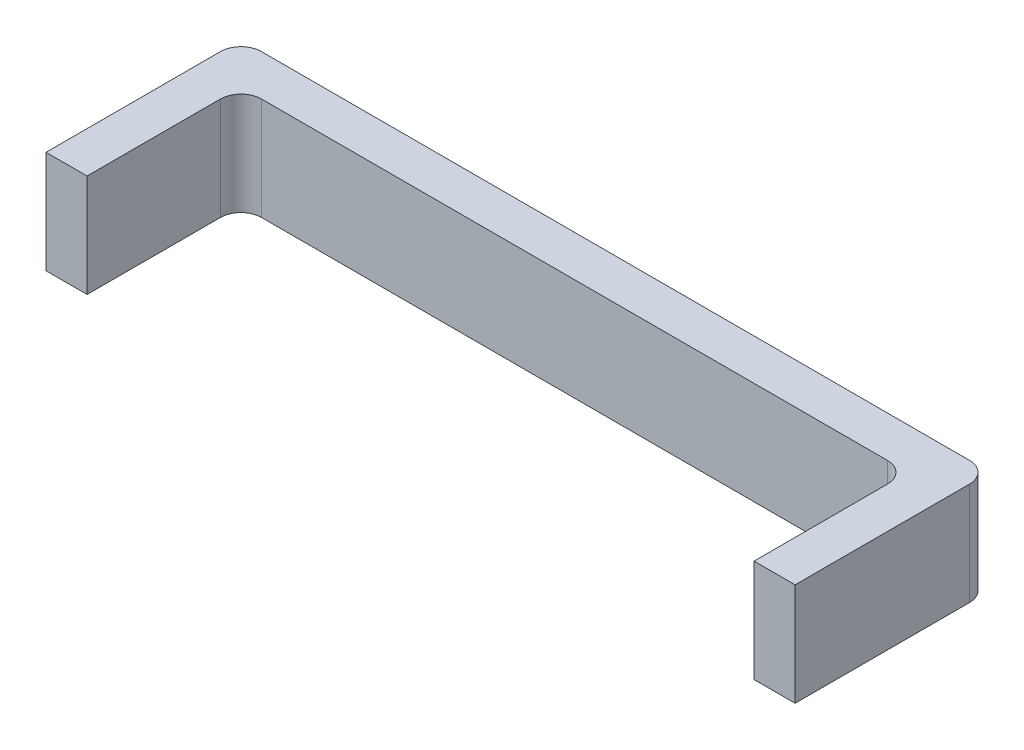
from build123d import *

# Parameters (mm, degrees)
BOSS_EXTRUDE1_DEPTH = 10
FILLET1_R           = 2


with BuildPart() as part:
    # Sketch1 → Boss-Extrude1 (new body)
    with BuildSketch(Plane(origin=(0, 0, 0), x_dir=(1, 0, 0), z_dir=(0, 1, 0))):
        Polygon((-32.5, 0), (32.5, 0), (32.5, -15), (36.5, -15), (36.5, 4), (-36.5, 4), (-36.5, -15), (-32.5, -15), align=None)
    extrude(amount=BOSS_EXTRUDE1_DEPTH)

    # Fillet1
    fillet1_edges = [part.edges().sort_by_distance(p)[0] for p in [
        (-36.5, 5, -4),
        (36.5, 5, -4),
        (32.5, 5, 0),
        (-32.5, 5, 0),
    ]]
    fillet(fillet1_edges, radius=FILLET1_R)


solid = part.part
